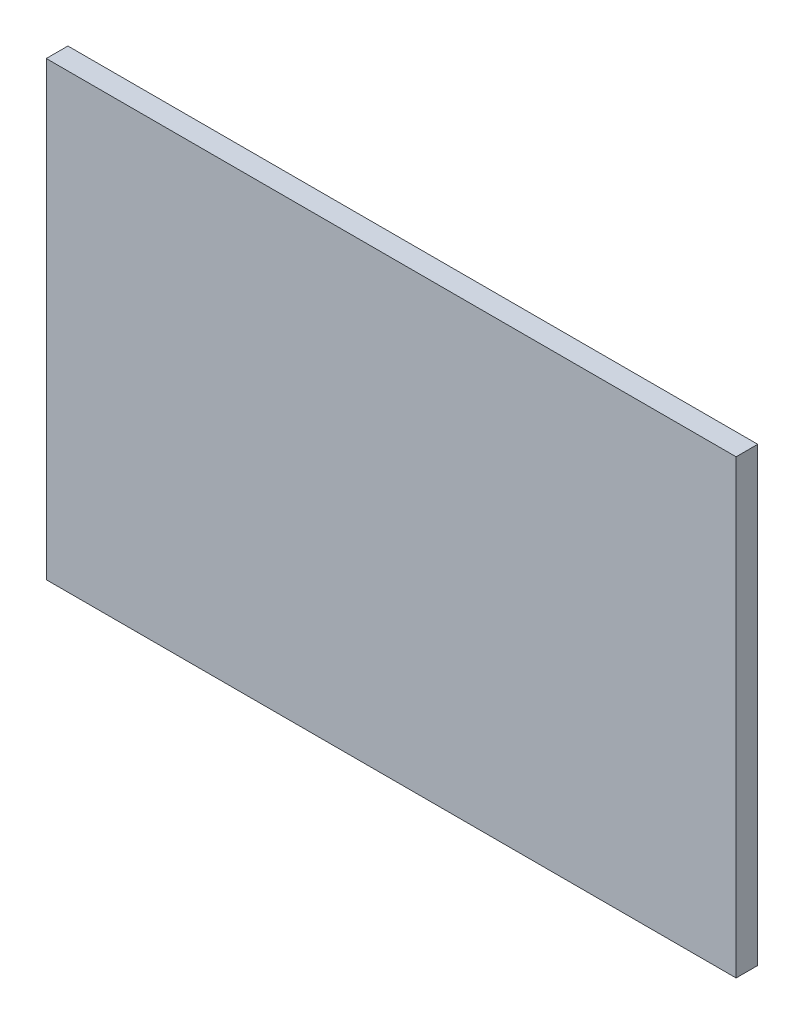
from build123d import *

# Parameters (mm, degrees)
SKETCH_1_W      = 398.5
SKETCH_1_H      = 260.75
EXTRUDE_1_DEPTH = 12.5


with BuildPart() as part:
    # Эскиз1 → Бобышка-Вытянуть1 (new body)
    with BuildSketch(Plane.XY):
        with Locations((-200.75, -130.375)):
            Rectangle(SKETCH_1_W, SKETCH_1_H)
    extrude(amount=-EXTRUDE_1_DEPTH)


solid = part.part
